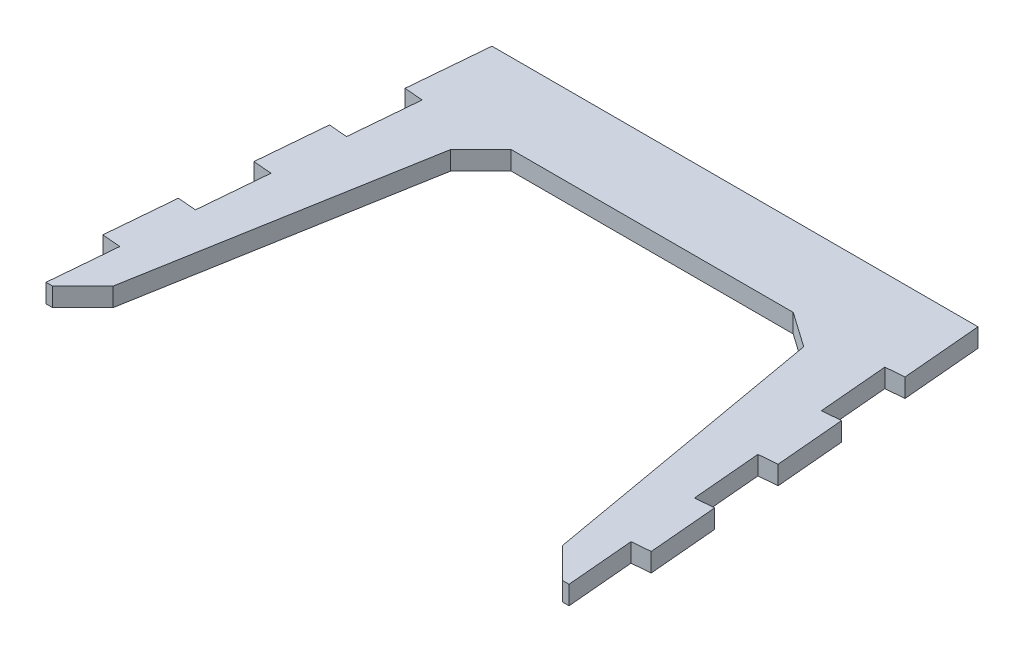
from build123d import *
from OCP.BRepFilletAPI import BRepFilletAPI_MakeChamfer

# Parameters (mm, degrees)
BOSS_EXTRUDE1_DEPTH = 15
CHAMFER1_SIZE       = 20
CHAMFER1_SIZE2      = 24.644345169
CHAMFER2_SIZE       = 20
CHAMFER2_SIZE2      = 24.644345169
CHAMFER3_SIZE       = 20
CHAMFER3_SIZE2      = 24.644345169
CUT_EXTRUDE1_DEPTH  = 411.634172553


with BuildPart() as part:
    # Sketch2 → Boss-Extrude1 (new body)
    with BuildSketch(Plane(origin=(0, 0, 0), x_dir=(1, 0, 0), z_dir=(0, 1, 0))):
        Polygon((-195.090568581, 343.177241046), (-224.999566436, 0), (-184.654847842, 0), (-135.549804353, 279.031716914), (135.549804353, 279.031716914), (184.654847842, 0), (224.999566436, 0), (195.090568581, 343.177241046), align=None)
    extrude(amount=-BOSS_EXTRUDE1_DEPTH)

    # Chamfer1: one chamfer whose edges measure the first distance from different faces: ONE call of the kernel's chamfer builder (chamfer() names one face for all edges)
    chamfer1_edges_1 = [part.edges().sort_by_distance(p)[0] for p in [
        (135.549804353, -7.5, -279.031716914),
    ]]
    chamfer1_side_1 = [part.faces().sort_by_distance(p)[0] for p in [
        (160.102326098, -7.5, -139.515858457),
    ]]
    chamfer1_edges_2 = [part.edges().sort_by_distance(p)[0] for p in [
        (-135.549804353, -7.5, -279.031716914),
    ]]
    chamfer1_side_2 = [part.faces().sort_by_distance(p)[0] for p in [
        (0, -7.5, -279.031716914),
    ]]
    chamfer1 = BRepFilletAPI_MakeChamfer(part.part.solid().wrapped)
    for e in chamfer1_edges_1:
        chamfer1.Add(CHAMFER1_SIZE, CHAMFER1_SIZE2, e.wrapped, chamfer1_side_1[0].wrapped)  # the first distance lies on this face
    for e in chamfer1_edges_2:
        chamfer1.Add(CHAMFER1_SIZE, CHAMFER1_SIZE2, e.wrapped, chamfer1_side_2[0].wrapped)  # the first distance lies on this face
    add(Compound.cast(chamfer1.Shape()), mode=Mode.REPLACE)

    # Chamfer2
    chamfer2_edges = [part.edges().sort_by_distance(p)[0] for p in [
        (184.654847842, -7.5, 0),
    ]]
    chamfer2_side = [part.faces().sort_by_distance(p)[0] for p in [
        (204.827207139, -7.5, 0),
    ]]
    chamfer(chamfer2_edges, length=CHAMFER2_SIZE, length2=CHAMFER2_SIZE2, reference=chamfer2_side[0])

    # Chamfer3
    chamfer3_edges = [part.edges().sort_by_distance(p)[0] for p in [
        (-184.654847842, -7.5, 0),
    ]]
    chamfer3_side = [part.faces().sort_by_distance(p)[0] for p in [
        (-204.827207139, -7.5, 0),
    ]]
    chamfer(chamfer3_edges, length=CHAMFER3_SIZE, length2=CHAMFER3_SIZE2, reference=chamfer3_side[0])

    # Sketch3 → Cut-Extrude1 (cut, through all)
    with BuildSketch(Plane(origin=(0, 0, 0), x_dir=(1, 0, 0), z_dir=(0, 1, 0))):
        Polygon((200.68105686, 279.031716914), (185.737267566, 277.729317721), (190.600969481, 221.922974338), (205.544758775, 223.225373531), align=None)
        Polygon((210.40846069, 167.419030149), (195.464671397, 166.116630955), (200.328373312, 110.310287572), (215.272162606, 111.612686766), align=None)
        Polygon((209.942268873, 0), (224.999566436, 0), (220.135864521, 55.806343383), (205.192075227, 54.503944189), align=None)
    cut_extrude1 = extrude(amount=-CUT_EXTRUDE1_DEPTH, mode=Mode.SUBTRACT)

    # Mirror1: Cut-Extrude1 across plane
    add(cut_extrude1.mirror(Plane(origin=(0, 0, 0), x_dir=(0, 0, 1), z_dir=(1, 0, 0))), mode=Mode.SUBTRACT)


solid = part.part
